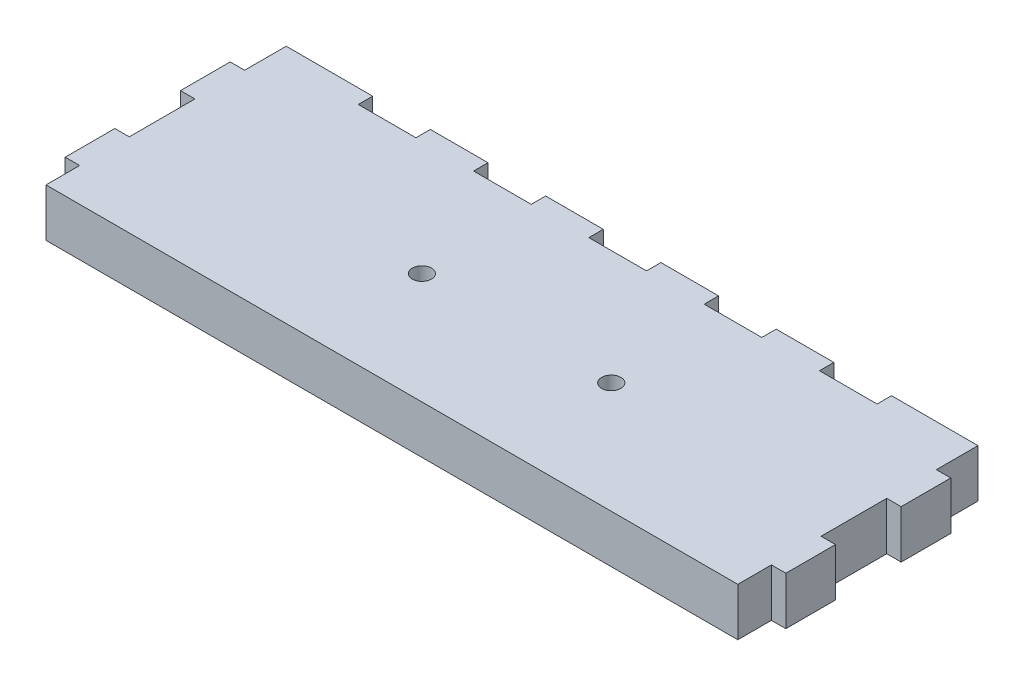
from build123d import *

# Parameters (mm, degrees)
BOSS_EXTRUDE1_DEPTH = 10
SKETCH2_R           = 1.997822351
SKETCH2_R_2         = 2.000000328
CUT_EXTRUDE1_DEPTH  = 107.961093012


with BuildPart() as part:
    # Sketch1 → Boss-Extrude1 (new body)
    with BuildSketch(Plane(origin=(0, 0, 0), x_dir=(1, 0, 0), z_dir=(0, 1, 0))):
        Polygon((-32.812912017, 69.703683257), (-20.812911913, 69.703683257), (-20.812911913, 72.703689337), (-8.812911808, 72.703689337), (-8.812911808, 69.703683257), (3.187088063, 69.703683257), (3.187088063, 72.703689337), (15.1870884, 72.703689337), (15.1870884, 69.703683257), (27.187088504, 69.703683257), (27.187088504, 72.703689337), (39.187088609, 72.703689337), (39.187088609, 69.703683257), (51.18708685, 69.703683257), (51.18708685, 72.703689337), (69.187089801, 72.703689337), (69.187089801, 69.703683257), (69.187089801, 64.03671205), (72.18708843, 64.03671205), (72.18708843, 53.703688085), (69.187089801, 53.703688085), (69.187089801, 40.036708117), (72.18708843, 40.036708117), (72.18708843, 29.703684151), (69.187089801, 29.703684151), (69.187089801, 22.703684866), (-74.812911451, 22.703684866), (-74.812911451, 29.703684151), (-77.81291008, 29.703684151), (-77.81291008, 40.036708117), (-74.812911451, 40.036708117), (-74.812911451, 53.703688085), (-77.81291008, 53.703688085), (-77.81291008, 64.03671205), (-74.812911451, 64.03671205), (-74.812911451, 69.703683257), (-74.812911451, 72.703689337), (-56.812912226, 72.703689337), (-56.812912226, 69.703683257), (-44.812910259, 69.703683257), (-44.812910259, 72.703689337), (-32.812912017, 72.703689337), align=None)
    extrude(amount=BOSS_EXTRUDE1_DEPTH)

    # Sketch2 → Cut-Extrude1 (cut, through all)
    with BuildSketch(Plane(origin=(0, 10, 0), x_dir=(1, 0, 0), z_dir=(0, 1, 0))):
        with Locations(Location((-19.704415408, 45.837319398, 0), (0, 0, 270))):
            Circle(SKETCH2_R)
        with Locations(Location((19.706618041, 45.84139958, 0), (0, 0, 270))):
            Circle(SKETCH2_R_2)
    extrude(amount=-CUT_EXTRUDE1_DEPTH, mode=Mode.SUBTRACT)


solid = part.part
